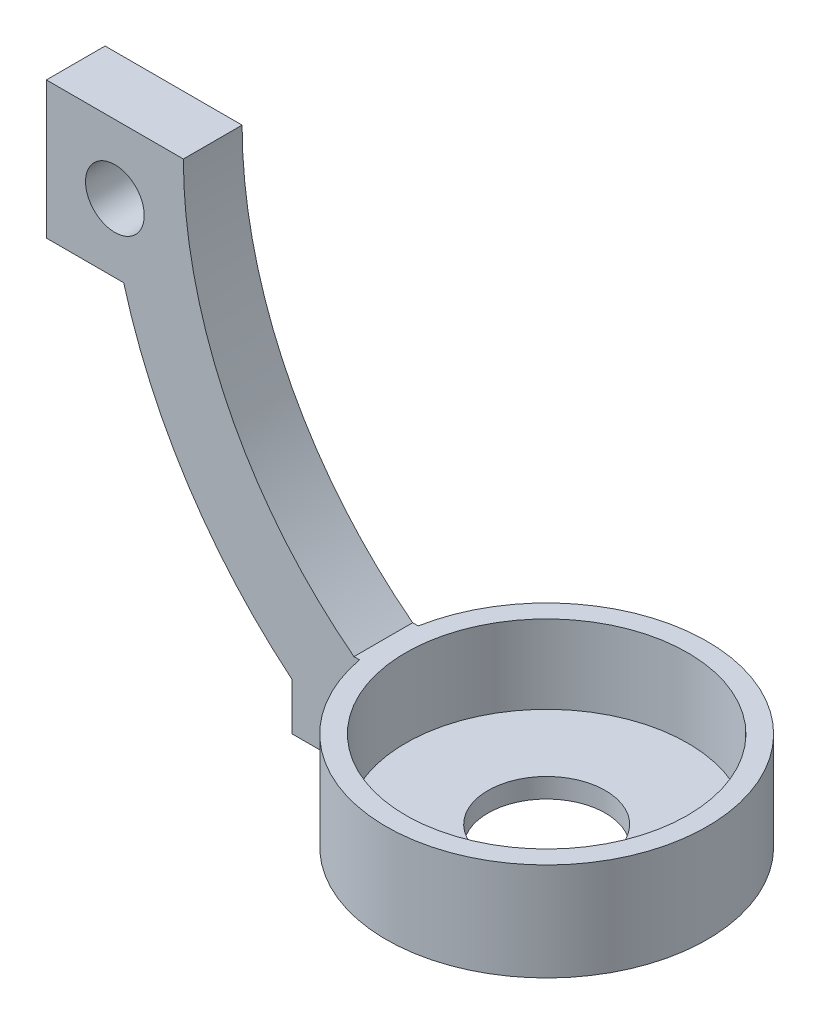
from build123d import *

# Parameters (mm, degrees)
SKETCH4_R           = 0.75
BOSS_EXTRUDE1_DEPTH = 1.5
BOSS_EXTRUDE2_REACH = 19.027
SKETCH3_W           = 2.850862197
SKETCH3_H           = 1.5
CUT_EXTRUDE1_START  = -2
SKETCH5_R           = 3.6
CUT_EXTRUDE1_DEPTH  = 2


with BuildPart() as part:
    # Sketch1 → Revolve1 (revolve)
    with BuildSketch(Plane.XY):
        Polygon((4.1, 0), (4.1, 2.5), (3.6, 2.5), (3.6, 0.5), (1.5, 0.5), (1.5, 0), align=None)
    revolve(axis=Axis((0, 0, 0), (0, 1, 0)))

    # Boss-Extrude2: up to this face of the body (flat: up to its plane)
    boss_extrude2_end = Plane(part.part.faces().sort_by_distance((-3.984034488, 2.5, 0))[0])
    # Sketch3 → Boss-Extrude2 (add, up to the picked face)
    with BuildSketch(Plane.XZ, mode=Mode.PRIVATE) as boss_extrude2_sk1:
        with Locations((-4.324568902, 0)):
            Rectangle(SKETCH3_W, SKETCH3_H)
    boss_extrude2_tool1 = split(extrude(boss_extrude2_sk1.sketch, amount=-BOSS_EXTRUDE2_REACH, mode=Mode.PRIVATE), bisect_by=boss_extrude2_end, keep=Keep.BOTH, mode=Mode.PRIVATE)


with BuildPart() as body_2:
    # Sketch4 → Boss-Extrude1 (new body)
    with BuildSketch(Plane.XY.offset(-0.75)):
        with BuildLine():
            Line((-8.530818775, 11.33), (-12.030818775, 11.33))
            Line((-12.030818775, 11.33), (-12.030818775, 7.83))
            Line((-12.030818775, 7.83), (-10.055529403, 7.83))
            ThreePointArc((-10.055529403, 7.83), (-7.808057008, 3.326468933), (-4.030818775, 0))
            Line((-4.030818775, 0), (-4.172844356, 2.5))
            ThreePointArc((-4.172844356, 2.5), (-7.382007257, 6.406565197), (-8.530818775, 11.33))
        make_face()
        with Locations((-10.280818775, 9.58)):
            Circle(SKETCH4_R, mode=Mode.SUBTRACT)
    extrude(amount=BOSS_EXTRUDE1_DEPTH)


with BuildPart() as part_1:
    add(part.part)

    add(body_2.part)  # Boss-Extrude2 merges body 2
    add(boss_extrude2_tool1.solids().sort_by(Axis((-4.324569, 0, 0), (0, 1, 0)))[0])

    # Sketch5 → Cut-Extrude1 (cut)
    with BuildSketch(Plane(origin=(0, 2.5, 0), x_dir=(1, 0, 0), z_dir=(0, 1, 0)).offset(CUT_EXTRUDE1_START)):
        Circle(SKETCH5_R)
    extrude(amount=CUT_EXTRUDE1_DEPTH, mode=Mode.SUBTRACT)


solid = part_1.part
